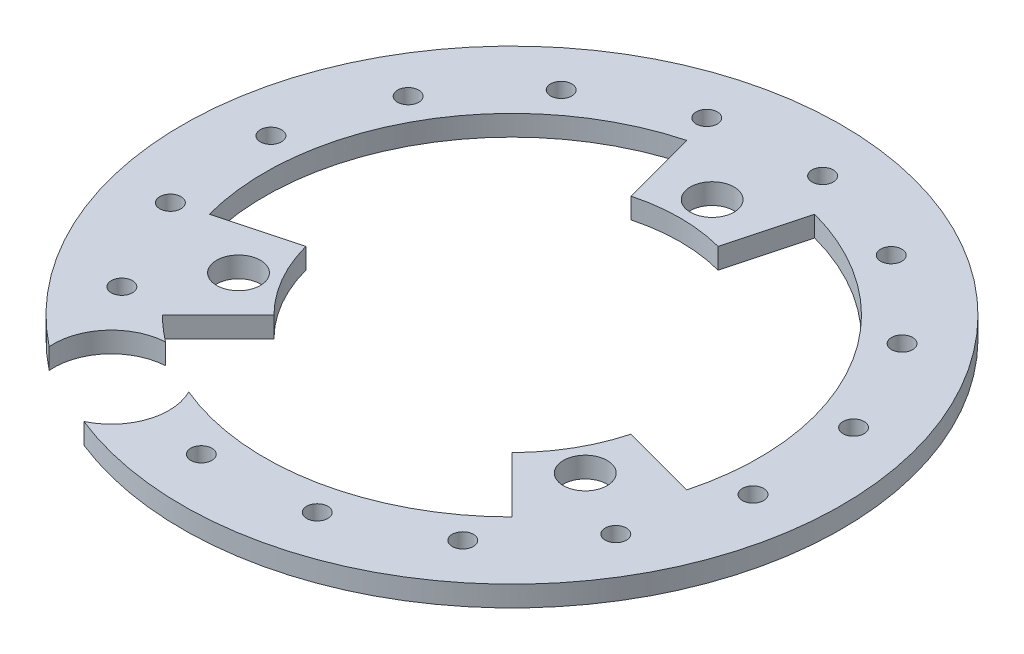
from build123d import *

# Parameters (mm, degrees)
SKETCH1_R          = 101.6
EXTRUDE1_DEPTH     = 6.35
SKETCH3_R          = 51.8922
CUT_EXTRUDE2_DEPTH = 6.35
SKETCH5_R          = 6.746875
CUT_EXTRUDE4_DEPTH = 6.35
CIRPATTERN1_COUNT  = 3
SKETCH16_R         = 17.78
CUT_EXTRUDE5_DEPTH = 6.35
CUT_EXTRUDE9_DEPTH = 6.35
CIRPATTERN2_COUNT  = 3
CIRPATTERN3_COUNT  = 16


with BuildPart() as part:
    # Sketch1 → Extrude1 (new body)
    with BuildSketch(Plane(origin=(0, 0, 0), x_dir=(1, 0, 0), z_dir=(0, 1, 0))):
        with Locations(Location((0, 0, 0), (0, 0, 270))):
            Circle(SKETCH1_R)
    extrude(amount=EXTRUDE1_DEPTH)

    # Sketch3 → Cut-Extrude2 (cut)
    with BuildSketch(Plane(origin=(0, 0, 0), x_dir=(1, 0, 0), z_dir=(0, 1, 0))):
        with Locations(Location((0, 0, 0), (0, 0, 270))):
            Circle(SKETCH3_R)
    extrude(amount=CUT_EXTRUDE2_DEPTH, mode=Mode.SUBTRACT)

    # Sketch5 → Cut-Extrude4 (cut)
    with BuildSketch(Plane(origin=(0, 0, 0), x_dir=(1, 0, 0), z_dir=(0, 1, 0))):
        with Locations(Location((0, 61.722, 0), (0, 0, 270))):
            Circle(SKETCH5_R)
    cut_extrude4 = extrude(amount=CUT_EXTRUDE4_DEPTH, mode=Mode.SUBTRACT)

    # CirPattern1: Cut-Extrude4 ×3 about axis
    cirpattern1_axis = Axis((0, 0, 0), (0, 1, 0))
    for i in range(1, CIRPATTERN1_COUNT):
        add(cut_extrude4.rotate(cirpattern1_axis, i * 360 / CIRPATTERN1_COUNT), mode=Mode.SUBTRACT)

    # Sketch16 → Cut-Extrude5 (cut)
    with BuildSketch(Plane(origin=(0, 0, 0), x_dir=(1, 0, 0), z_dir=(0, 1, 0))):
        with Locations((-45.212, -78.309481112)):
            Circle(SKETCH16_R)
    extrude(amount=CUT_EXTRUDE5_DEPTH, mode=Mode.SUBTRACT)

    # Sketch17 → Cut-Extrude9 (cut)
    with BuildSketch(Plane(origin=(0, 0, 0), x_dir=(1, 0, 0), z_dir=(0, 1, 0))):
        with BuildLine():
            Line((-13.430689652, 50.124016163), (-19.722011237, 73.603547963))
            ThreePointArc((-19.722011237, 73.603547963), (-65.991135768, 38.1), (-73.603547963, -19.722011237))
            Line((-73.603547963, -19.722011237), (-50.124016163, -13.430689652))
            ThreePointArc((-50.124016163, -13.430689652), (-44.939963458, 25.9461), (-13.430689652, 50.124016163))
        make_face()
    cut_extrude9 = extrude(amount=CUT_EXTRUDE9_DEPTH, mode=Mode.SUBTRACT)

    # CirPattern2: Cut-Extrude9 ×3 about axis
    cirpattern2_axis = Axis((0, 0, 0), (0, 1, 0))
    for i in range(1, CIRPATTERN2_COUNT):
        add(cut_extrude9.rotate(cirpattern2_axis, i * 360 / CIRPATTERN2_COUNT), mode=Mode.SUBTRACT)

    # Sketch23 → F (0.257) Diameter Hole1 (revolve, cut)
    with BuildSketch(Plane(origin=(42.459430359, 6.35, -74.471285732), x_dir=(0, 0, 1), z_dir=(1, 0, 0))):
        Polygon((0, 0), (0, 60.381148974), (3.2639, 58.42), (3.2639, 0), align=None)
    f_0_257_diameter_hole1 = revolve(axis=Axis((42.459430359, 12.7, -74.471285732), (0, -1, 0)), mode=Mode.SUBTRACT)

    # CirPattern3: F (0.257) Diameter Hole1 ×16 about axis, 1 skipped
    cirpattern3_axis = Axis((0, 0, 0), (0, 1, 0))
    add([f_0_257_diameter_hole1.rotate(cirpattern3_axis, i * 360 / CIRPATTERN3_COUNT) for i in range(1, CIRPATTERN3_COUNT) if i not in (8,)], mode=Mode.SUBTRACT)


solid = part.part
